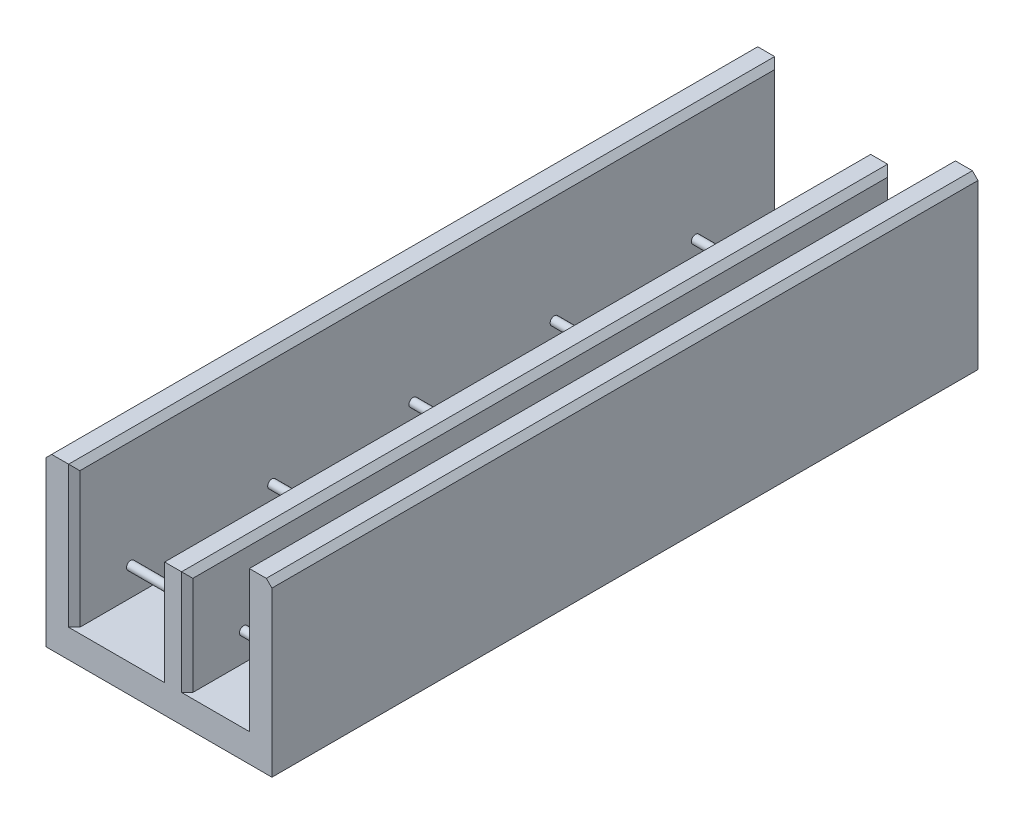
from build123d import *

# Parameters (mm, degrees)
SALIENTE_EXTRUIR1_DEPTH = 2500
CHAFL_N2_SIZE           = 20
SALIENTE_EXTRUIR2_REACH = 2694.582
CROQUIS2_R              = 15
MATRIZL1_COUNT          = 5
MATRIZL1_PITCH          = 500


with BuildPart() as part:
    # Croquis1 → Saliente-Extruir1 (new body)
    with BuildSketch(Plane.XY):
        Polygon((0, 0), (-800, 0), (-800, 600), (-700, 600), (-700, 100), (-400, 100), (-400, 470), (-300, 470), (-300, 100), (-100, 100), (-100, 600), (0, 600), align=None)
    extrude(amount=SALIENTE_EXTRUIR1_DEPTH)

    # Chaflán2
    chafl_n2_edges = [part.edges().sort_by_distance(p)[0] for p in [
        (-100, 350, 2500),
        (-700, 350, 0),
        (-400, 285, 0),
        (-300, 285, 0),
        (-100, 350, 0),
        (-300, 285, 2500),
        (-800, 600, 1250),
        (-700, 600, 1250),
        (-400, 470, 1250),
        (-300, 470, 1250),
        (-100, 600, 1250),
        (0, 600, 1250),
        (-400, 285, 2500),
        (-700, 350, 2500),
    ]]
    chamfer(chafl_n2_edges, length=CHAFL_N2_SIZE)

    # Saliente-Extruir2: up to this face of the body (flat: up to its plane)
    saliente_extruir2_end = Plane(part.part.faces().sort_by_distance((-100, 340, 1250))[0])
    # Croquis2 → Saliente-Extruir2 (add, up to the picked face)
    with BuildSketch(Plane.ZY.offset(800), mode=Mode.PRIVATE) as saliente_extruir2_sk1:
        with Locations(Location((300, 200, 0), (0, 0, 270))):
            Circle(CROQUIS2_R)
    saliente_extruir2_tool1 = split(extrude(saliente_extruir2_sk1.sketch, amount=-SALIENTE_EXTRUIR2_REACH, mode=Mode.PRIVATE), bisect_by=saliente_extruir2_end, keep=Keep.BOTH, mode=Mode.PRIVATE)
    saliente_extruir2 = saliente_extruir2_tool1.solids().sort_by(Axis((-800, 200, 300), (1, 0, 0)))[0]
    add(saliente_extruir2)

    # MatrizL1: Saliente-Extruir2 ×5
    with Locations(*[(0, 0, i * MATRIZL1_PITCH) for i in range(1, MATRIZL1_COUNT)]):
        add(saliente_extruir2)


solid = part.part
